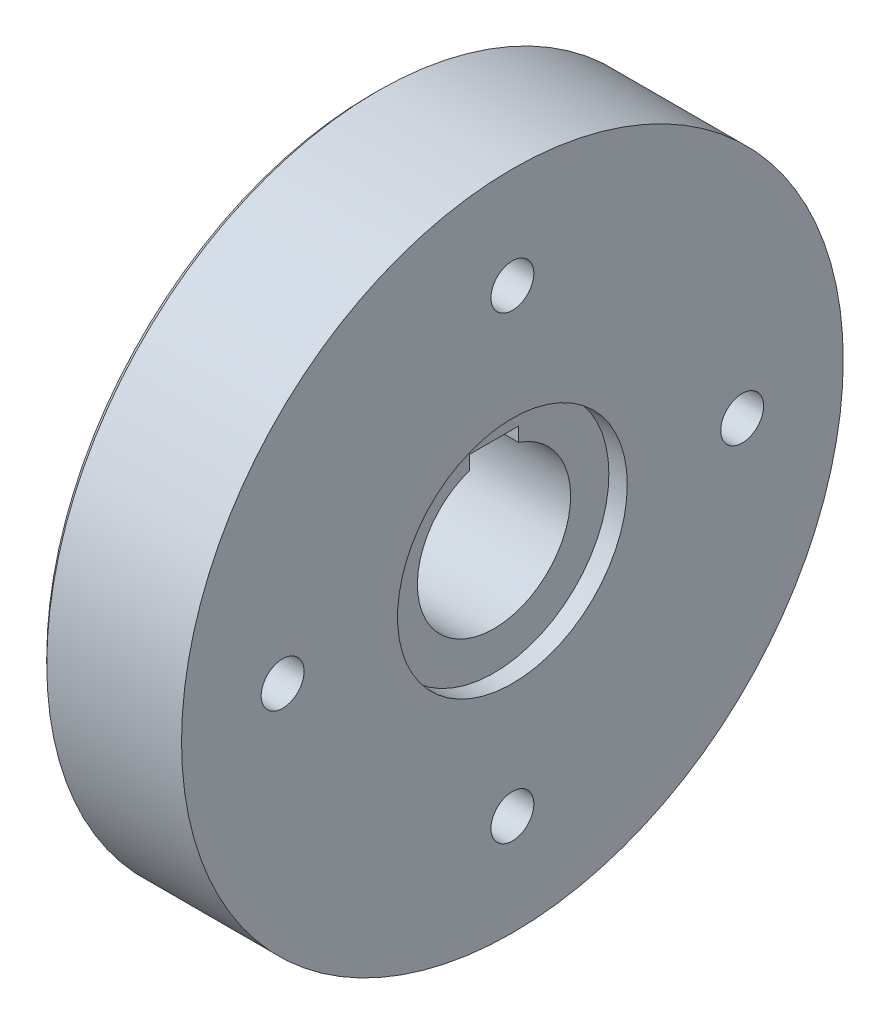
from build123d import *

# Parameters (mm, degrees)
M16X2_0_TAPPED_HOLE1_D = 14
SKETCH4_W              = 21
SKETCH4_H              = 8
CUT_EXTRUDE1_DEPTH     = 8
CHAMFER2_SIZE          = 2
CUT_EXTRUDE2_START     = -11
SKETCH6_R              = 37.5
CUT_EXTRUDE2_DEPTH     = 11


with BuildPart() as part:
    # Sketch1 → Revolve1 (revolve)
    with BuildSketch(Plane.XY, mode=Mode.PRIVATE) as revolve1_sk:
        Polygon((-40, 25), (40, 25), (45, 25), (45, 37.5), (40, 37.5), (40, 108), (15, 108), (15, 50), (-40, 50), align=None)
    revolve(revolve1_sk.sketch.rotate(Axis((-40, 0, 0), (1, 0, 0)), 90), axis=Axis((-40, 0, 0), (1, 0, 0)))

    # M16x2.0 Tapped Hole1 (through all)
    with Locations(Plane(origin=(40, 0, 0), x_dir=(0, 0, -1), z_dir=(1, 0, 0))):
        with Locations((-75, 0), (0, 75), (75, 0), (0, -75)):
            Hole(M16X2_0_TAPPED_HOLE1_D / 2)

    # Sketch4 → Revolve2 (revolve)
    with BuildSketch(Plane.XY, mode=Mode.PRIVATE) as revolve2_sk:
        with Locations((4.5, 104)):
            Rectangle(SKETCH4_W, SKETCH4_H)
    revolve(revolve2_sk.sketch.rotate(Axis((0, 0, 0), (1, 0, 0)), 90), axis=Axis((0, 0, 0), (1, 0, 0)))

    # Sketch5 → Cut-Extrude1 (cut, symmetric)
    with BuildSketch(Plane.XY):
        Polygon((-40, 0), (45, 0), (45, 28.4), (-40, 27.55), align=None)
    extrude(amount=CUT_EXTRUDE1_DEPTH, both=True, mode=Mode.SUBTRACT)

    # Chamfer2
    chamfer2_edges = [part.edges().sort_by_distance(p)[0] for p in [
        (45, 0, -37.5),
        (-6, 0, -108),
        (-40, 0, -50),
        (15, 0, -50),
    ]]
    chamfer(chamfer2_edges, length=CHAMFER2_SIZE)

    # Sketch6 → Cut-Extrude2 (cut)
    with BuildSketch(Plane(origin=(45, 0, 0), x_dir=(0, 0, -1), z_dir=(1, 0, 0)).offset(CUT_EXTRUDE2_START)):
        Circle(SKETCH6_R)
    extrude(amount=CUT_EXTRUDE2_DEPTH, mode=Mode.SUBTRACT)


solid = part.part
